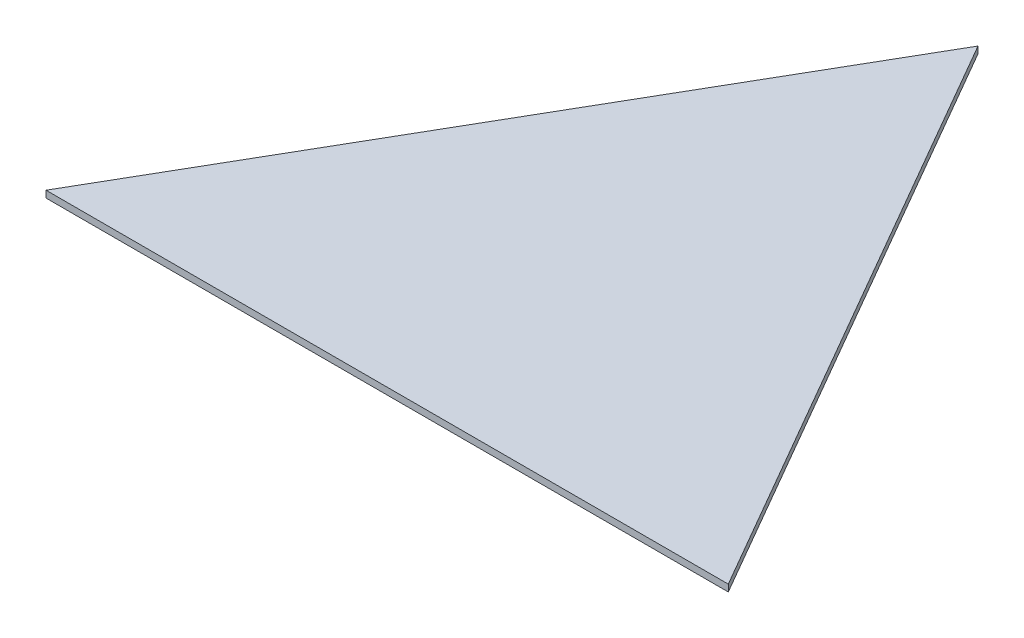
from build123d import *

# Parameters (mm, degrees)
BOSS_EXTRUDE1_DEPTH = 5


with BuildPart() as part:
    # Sketch1 → Boss-Extrude1 (new body)
    with BuildSketch(Plane(origin=(0, 0, 0), x_dir=(1, 0, 0), z_dir=(0, 1, 0))):
        Polygon((250, -144.337567297), (0, 288.675134595), (-250, -144.337567297), align=None)
    extrude(amount=BOSS_EXTRUDE1_DEPTH)


solid = part.part
